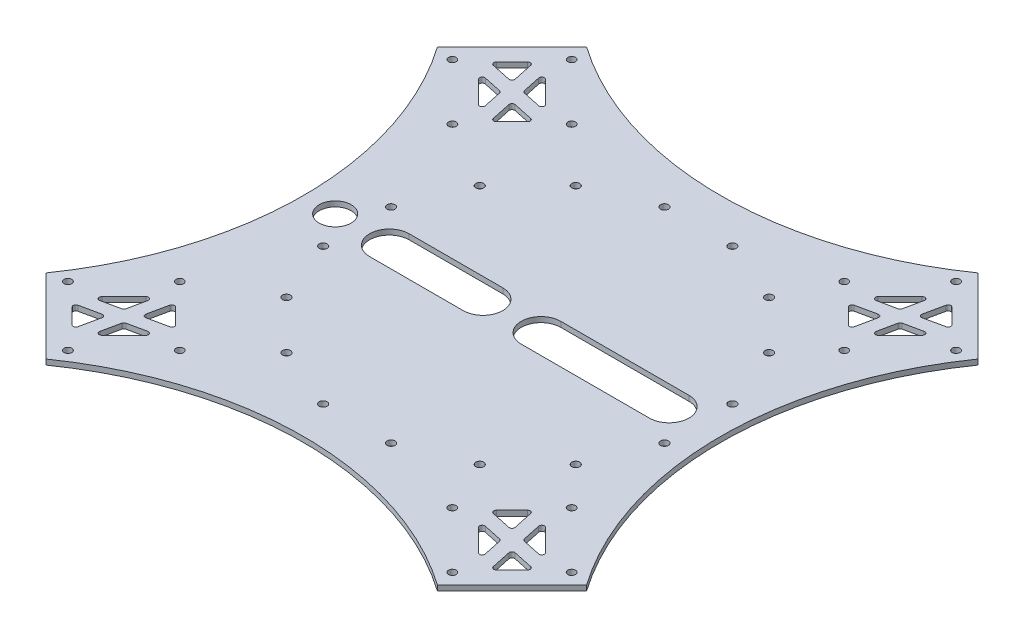
from build123d import *

# Parameters (mm, degrees)
EXTRUDE_1_DEPTH          = 2
HOLE_WIZARD_1_D          = 2.9
HOLE_WIZARD_1_DEPTH      = 100
CUT_EXTRUDE_2_DEPTH      = 146.013792447
CUT_EXTRUDE_2_DEPTH_BACK = 146.013792447
CUT_EXTRUDE_3_DEPTH      = 146.013792447
CUT_EXTRUDE_3_DEPTH_BACK = 146.013792447
SKETCH_8_R               = 129.444320441
CUT_EXTRUDE_4_DEPTH      = 146.013792447
CUT_EXTRUDE_4_DEPTH_BACK = 146.013792447
SKETCH_9_R               = 6.05
CUT_EXTRUDE_5_DEPTH      = 146.013792447
CUT_EXTRUDE_5_DEPTH_BACK = 146.013792447
SKETCH_12_R              = 1.5
CUT_EXTRUDE_6_DEPTH      = 146.013792447
CUT_EXTRUDE_6_DEPTH_BACK = 146.013792447


with BuildPart() as part:
    # 草图1 → 凸台-拉伸1 (new body)
    with BuildSketch(Plane(origin=(0, 0, 0), x_dir=(1, 0, 0), z_dir=(0, 1, 0))):
        Polygon((-74.246212025, 102.530483272), (-102.530483272, 74.246212025), (-102.530483272, -74.246212025), (-74.246212025, -102.530483272), (74.246212025, -102.530483272), (102.530483272, -74.246212025), (102.530483272, 74.246212025), (74.246212025, 102.530483272), align=None)
    extrude(amount=EXTRUDE_1_DEPTH)

    # 孔1
    with Locations(Plane(origin=(0, 2, 0), x_dir=(1, 0, 0), z_dir=(0, 1, 0))):
        with Locations((-95.539712665, 72.915895741), (-74.326509229, 51.702692305), (-51.699092231, 74.330109303), (-72.912295667, 95.543312739), (72.915895741, 95.539712665), (51.702692305, 74.326509229), (74.330109303, 51.699092231), (95.543312739, 72.912295667), (95.539712665, -72.915895741), (74.326509229, -51.702692305), (51.699092231, -74.330109303), (72.912295667, -95.543312739), (-72.915895741, -95.539712665), (-51.702692305, -74.326509229), (-74.330109303, -51.699092231), (-95.543312739, -72.912295667)):
            Hole(HOLE_WIZARD_1_D / 2, depth=HOLE_WIZARD_1_DEPTH)

    # 草图7 → 切除-拉伸2 (cut, two sides: drawn at the far end of the back side and taken through both)
    with BuildSketch(Plane(origin=(0, 2, 0), x_dir=(1, 0, 0), z_dir=(0, 1, 0)).offset(-CUT_EXTRUDE_2_DEPTH_BACK)):
        with BuildLine():
            Line((-86.393024897, 80.484175463), (-80.480575389, 86.396624971))
            ThreePointArc((-80.480575389, 86.396624971), (-79.489849579, 86.64845523), (-78.795493206, 85.89823837))
            Line((-78.795493206, 85.89823837), (-77.191282416, 78.381578071))
            ThreePointArc((-77.191282416, 78.381578071), (-77.462151036, 77.46575111), (-78.377977997, 77.194882489))
            Line((-78.377977997, 77.194882489), (-85.894638296, 78.79909328))
            ThreePointArc((-85.894638296, 78.79909328), (-86.644855156, 79.493449653), (-86.393024897, 80.484175463))
        make_face()
        with BuildLine():
            Line((-84.160083838, 71.435761851), (-75.806643119, 63.082321131))
            ThreePointArc((-75.806643119, 63.082321131), (-74.622014392, 62.91080809), (-74.121560936, 63.998148093))
            Line((-74.121560936, 63.998148093), (-75.590793382, 70.882356366))
            ThreePointArc((-75.590793382, 70.882356366), (-75.861662002, 71.380742967), (-76.360048603, 71.651611588))
            Line((-76.360048603, 71.651611588), (-83.244256877, 73.120844034))
            ThreePointArc((-83.244256877, 73.120844034), (-84.331596879, 72.620390577), (-84.160083838, 71.435761851))
        make_face()
        with BuildLine():
            Line((-71.432161777, 84.163683912), (-63.078721058, 75.810243193))
            ThreePointArc((-63.078721058, 75.810243193), (-62.907208017, 74.625614466), (-63.994548019, 74.12516101))
            Line((-63.994548019, 74.12516101), (-70.878756293, 75.594393456))
            ThreePointArc((-70.878756293, 75.594393456), (-71.377142893, 75.865262076), (-71.648011514, 76.363648677))
            Line((-71.648011514, 76.363648677), (-73.11724396, 83.247856951))
            ThreePointArc((-73.11724396, 83.247856951), (-72.616790503, 84.335196953), (-71.432161777, 84.163683912))
        make_face()
        with BuildLine():
            Line((-66.758229507, 60.849380072), (-60.845779998, 66.761829581))
            ThreePointArc((-60.845779998, 66.761829581), (-60.59394974, 67.752555391), (-61.344166599, 68.446911764))
            Line((-61.344166599, 68.446911764), (-68.860826898, 70.051122554))
            ThreePointArc((-68.860826898, 70.051122554), (-69.77665386, 69.780253934), (-70.04752248, 68.864426972))
            Line((-70.04752248, 68.864426972), (-68.44331169, 61.347766673))
            ThreePointArc((-68.44331169, 61.347766673), (-67.748955317, 60.597549814), (-66.758229507, 60.849380072))
        make_face()
        with BuildLine():
            Line((80.484175463, 86.393024897), (86.396624971, 80.480575389))
            ThreePointArc((86.396624971, 80.480575389), (86.64845523, 79.489849579), (85.89823837, 78.795493206))
            Line((85.89823837, 78.795493206), (78.381578071, 77.191282416))
            ThreePointArc((78.381578071, 77.191282416), (77.46575111, 77.462151036), (77.194882489, 78.377977997))
            Line((77.194882489, 78.377977997), (78.79909328, 85.894638296))
            ThreePointArc((78.79909328, 85.894638296), (79.493449653, 86.644855156), (80.484175463, 86.393024897))
        make_face()
        with BuildLine():
            Line((71.435761851, 84.160083838), (63.082321131, 75.806643119))
            ThreePointArc((63.082321131, 75.806643119), (62.91080809, 74.622014392), (63.998148093, 74.121560936))
            Line((63.998148093, 74.121560936), (70.882356366, 75.590793382))
            ThreePointArc((70.882356366, 75.590793382), (71.380742967, 75.861662002), (71.651611588, 76.360048603))
            Line((71.651611588, 76.360048603), (73.120844034, 83.244256877))
            ThreePointArc((73.120844034, 83.244256877), (72.620390577, 84.331596879), (71.435761851, 84.160083838))
        make_face()
        with BuildLine():
            Line((84.163683912, 71.432161777), (75.810243193, 63.078721058))
            ThreePointArc((75.810243193, 63.078721058), (74.625614466, 62.907208017), (74.12516101, 63.994548019))
            Line((74.12516101, 63.994548019), (75.594393456, 70.878756293))
            ThreePointArc((75.594393456, 70.878756293), (75.865262076, 71.377142893), (76.363648677, 71.648011514))
            Line((76.363648677, 71.648011514), (83.247856951, 73.11724396))
            ThreePointArc((83.247856951, 73.11724396), (84.335196953, 72.616790503), (84.163683912, 71.432161777))
        make_face()
        with BuildLine():
            Line((60.849380072, 66.758229507), (66.761829581, 60.845779998))
            ThreePointArc((66.761829581, 60.845779998), (67.752555391, 60.59394974), (68.446911764, 61.344166599))
            Line((68.446911764, 61.344166599), (70.051122554, 68.860826898))
            ThreePointArc((70.051122554, 68.860826898), (69.780253934, 69.77665386), (68.864426972, 70.04752248))
            Line((68.864426972, 70.04752248), (61.347766673, 68.44331169))
            ThreePointArc((61.347766673, 68.44331169), (60.597549814, 67.748955317), (60.849380072, 66.758229507))
        make_face()
        with BuildLine():
            Line((86.393024897, -80.484175463), (80.480575389, -86.396624971))
            ThreePointArc((80.480575389, -86.396624971), (79.489849579, -86.64845523), (78.795493206, -85.89823837))
            Line((78.795493206, -85.89823837), (77.191282416, -78.381578071))
            ThreePointArc((77.191282416, -78.381578071), (77.462151036, -77.46575111), (78.377977997, -77.194882489))
            Line((78.377977997, -77.194882489), (85.894638296, -78.79909328))
            ThreePointArc((85.894638296, -78.79909328), (86.644855156, -79.493449653), (86.393024897, -80.484175463))
        make_face()
        with BuildLine():
            Line((84.160083838, -71.435761851), (75.806643119, -63.082321131))
            ThreePointArc((75.806643119, -63.082321131), (74.622014392, -62.91080809), (74.121560936, -63.998148093))
            Line((74.121560936, -63.998148093), (75.590793382, -70.882356366))
            ThreePointArc((75.590793382, -70.882356366), (75.861662002, -71.380742967), (76.360048603, -71.651611588))
            Line((76.360048603, -71.651611588), (83.244256877, -73.120844034))
            ThreePointArc((83.244256877, -73.120844034), (84.331596879, -72.620390577), (84.160083838, -71.435761851))
        make_face()
        with BuildLine():
            Line((71.432161777, -84.163683912), (63.078721058, -75.810243193))
            ThreePointArc((63.078721058, -75.810243193), (62.907208017, -74.625614466), (63.994548019, -74.12516101))
            Line((63.994548019, -74.12516101), (70.878756293, -75.594393456))
            ThreePointArc((70.878756293, -75.594393456), (71.377142893, -75.865262076), (71.648011514, -76.363648677))
            Line((71.648011514, -76.363648677), (73.11724396, -83.247856951))
            ThreePointArc((73.11724396, -83.247856951), (72.616790503, -84.335196953), (71.432161777, -84.163683912))
        make_face()
        with BuildLine():
            Line((66.758229507, -60.849380072), (60.845779998, -66.761829581))
            ThreePointArc((60.845779998, -66.761829581), (60.59394974, -67.752555391), (61.344166599, -68.446911764))
            Line((61.344166599, -68.446911764), (68.860826898, -70.051122554))
            ThreePointArc((68.860826898, -70.051122554), (69.77665386, -69.780253934), (70.04752248, -68.864426972))
            Line((70.04752248, -68.864426972), (68.44331169, -61.347766673))
            ThreePointArc((68.44331169, -61.347766673), (67.748955317, -60.597549814), (66.758229507, -60.849380072))
        make_face()
        with BuildLine():
            Line((-80.484175463, -86.393024897), (-86.396624971, -80.480575389))
            ThreePointArc((-86.396624971, -80.480575389), (-86.64845523, -79.489849579), (-85.89823837, -78.795493206))
            Line((-85.89823837, -78.795493206), (-78.381578071, -77.191282416))
            ThreePointArc((-78.381578071, -77.191282416), (-77.46575111, -77.462151036), (-77.194882489, -78.377977997))
            Line((-77.194882489, -78.377977997), (-78.79909328, -85.894638296))
            ThreePointArc((-78.79909328, -85.894638296), (-79.493449653, -86.644855156), (-80.484175463, -86.393024897))
        make_face()
        with BuildLine():
            Line((-71.435761851, -84.160083838), (-63.082321131, -75.806643119))
            ThreePointArc((-63.082321131, -75.806643119), (-62.91080809, -74.622014392), (-63.998148093, -74.121560936))
            Line((-63.998148093, -74.121560936), (-70.882356366, -75.590793382))
            ThreePointArc((-70.882356366, -75.590793382), (-71.380742967, -75.861662002), (-71.651611588, -76.360048603))
            Line((-71.651611588, -76.360048603), (-73.120844034, -83.244256877))
            ThreePointArc((-73.120844034, -83.244256877), (-72.620390577, -84.331596879), (-71.435761851, -84.160083838))
        make_face()
        with BuildLine():
            Line((-84.163683912, -71.432161777), (-75.810243193, -63.078721058))
            ThreePointArc((-75.810243193, -63.078721058), (-74.625614466, -62.907208017), (-74.12516101, -63.994548019))
            Line((-74.12516101, -63.994548019), (-75.594393456, -70.878756293))
            ThreePointArc((-75.594393456, -70.878756293), (-75.865262076, -71.377142893), (-76.363648677, -71.648011514))
            Line((-76.363648677, -71.648011514), (-83.247856951, -73.11724396))
            ThreePointArc((-83.247856951, -73.11724396), (-84.335196953, -72.616790503), (-84.163683912, -71.432161777))
        make_face()
        with BuildLine():
            Line((-60.849380072, -66.758229507), (-66.761829581, -60.845779998))
            ThreePointArc((-66.761829581, -60.845779998), (-67.752555391, -60.59394974), (-68.446911764, -61.344166599))
            Line((-68.446911764, -61.344166599), (-70.051122554, -68.860826898))
            ThreePointArc((-70.051122554, -68.860826898), (-69.780253934, -69.77665386), (-68.864426972, -70.04752248))
            Line((-68.864426972, -70.04752248), (-61.347766673, -68.44331169))
            ThreePointArc((-61.347766673, -68.44331169), (-60.597549814, -67.748955317), (-60.849380072, -66.758229507))
        make_face()
    extrude(amount=CUT_EXTRUDE_2_DEPTH + CUT_EXTRUDE_2_DEPTH_BACK, mode=Mode.SUBTRACT)

    # 草图8 → 切除-拉伸3 (cut, two sides: drawn at the far end of the back side and taken through both)
    with BuildSketch(Plane(origin=(0, 2, 0), x_dir=(1, 0, 0), z_dir=(0, 1, 0)).offset(-CUT_EXTRUDE_3_DEPTH_BACK)):
        with Locations((-208.565062983, 0)):
            Circle(SKETCH_8_R)
        with Locations((0, 208.565062983)):
            Circle(SKETCH_8_R)
        with Locations((208.565062983, 0)):
            Circle(SKETCH_8_R)
        with Locations((0, -208.565062983)):
            Circle(SKETCH_8_R)
    extrude(amount=CUT_EXTRUDE_3_DEPTH + CUT_EXTRUDE_3_DEPTH_BACK, mode=Mode.SUBTRACT)

    # 草图9 → 切除-拉伸4 (cut, two sides: drawn at the far end of the back side and taken through both)
    with BuildSketch(Plane(origin=(0, 2, 0), x_dir=(1, 0, 0), z_dir=(0, 1, 0)).offset(-CUT_EXTRUDE_4_DEPTH_BACK)):
        with Locations(Location((-67.070742542, 0, 0), (0, 0, 270))):
            Circle(SKETCH_9_R)
    extrude(amount=CUT_EXTRUDE_4_DEPTH + CUT_EXTRUDE_4_DEPTH_BACK, mode=Mode.SUBTRACT)

    # 草图12 → 切除-拉伸5 (cut, two sides: drawn at the far end of the back side and taken through both)
    with BuildSketch(Plane(origin=(0, 2, 0), x_dir=(1, 0, 0), z_dir=(0, 1, 0)).offset(-CUT_EXTRUDE_5_DEPTH_BACK)):
        with Locations(Location((-58.752571048, 12.875961253, 0), (0, 0, 270))):
            Circle(SKETCH_12_R)
        with Locations(Location((-48.897736954, 36.667635379, 0), (0, 0, 270))):
            Circle(SKETCH_12_R)
        with Locations(Location((-30.688377921, 54.876994412, 0), (0, 0, 270))):
            Circle(SKETCH_12_R)
        with Locations(Location((-6.896703795, 64.731828507, 0), (0, 0, 270))):
            Circle(SKETCH_12_R)
        with Locations(Location((18.855218711, 64.731828507, 0), (0, 0, 270))):
            Circle(SKETCH_12_R)
        with Locations(Location((42.646892837, 54.876994412, 0), (0, 0, 270))):
            Circle(SKETCH_12_R)
        with Locations(Location((60.85625187, 36.667635379, 0), (0, 0, 270))):
            Circle(SKETCH_12_R)
        with Locations(Location((70.711085965, 12.875961253, 0), (0, 0, 270))):
            Circle(SKETCH_12_R)
        with Locations(Location((70.711085965, -12.875961253, 0), (0, 0, 270))):
            Circle(SKETCH_12_R)
        with Locations(Location((60.85625187, -36.667635379, 0), (0, 0, 270))):
            Circle(SKETCH_12_R)
        with Locations(Location((42.646892837, -54.876994412, 0), (0, 0, 270))):
            Circle(SKETCH_12_R)
        with Locations(Location((18.855218711, -64.731828507, 0), (0, 0, 270))):
            Circle(SKETCH_12_R)
        with Locations(Location((-6.896703795, -64.731828507, 0), (0, 0, 270))):
            Circle(SKETCH_12_R)
        with Locations(Location((-30.688377921, -54.876994412, 0), (0, 0, 270))):
            Circle(SKETCH_12_R)
        with Locations(Location((-48.897736954, -36.667635379, 0), (0, 0, 270))):
            Circle(SKETCH_12_R)
        with Locations(Location((-58.752571048, -12.875961253, 0), (0, 0, 270))):
            Circle(SKETCH_12_R)
    extrude(amount=CUT_EXTRUDE_5_DEPTH + CUT_EXTRUDE_5_DEPTH_BACK, mode=Mode.SUBTRACT)

    # 草图13 → 切除-拉伸6 (cut, two sides: drawn at the far end of the back side and taken through both)
    with BuildSketch(Plane(origin=(0, 2, 0), x_dir=(1, 0, 0), z_dir=(0, 1, 0)).offset(-CUT_EXTRUDE_6_DEPTH_BACK)):
        with BuildLine():
            Line((-46.520742542, -7.5), (-11, -7.5))
            ThreePointArc((-11, -7.5), (-3.5, 0), (-11, 7.5))
            Line((-11, 7.5), (-46.520742542, 7.5))
            ThreePointArc((-46.520742542, 7.5), (-54.020742542, 0), (-46.520742542, -7.5))
        make_face()
        with BuildLine():
            Line((11, -7.5), (59.620742542, -7.5))
            ThreePointArc((59.620742542, -7.5), (67.120742542, 0), (59.620742542, 7.5))
            Line((59.620742542, 7.5), (11, 7.5))
            ThreePointArc((11, 7.5), (3.5, 0), (11, -7.5))
        make_face()
    extrude(amount=CUT_EXTRUDE_6_DEPTH + CUT_EXTRUDE_6_DEPTH_BACK, mode=Mode.SUBTRACT)


solid = part.part
